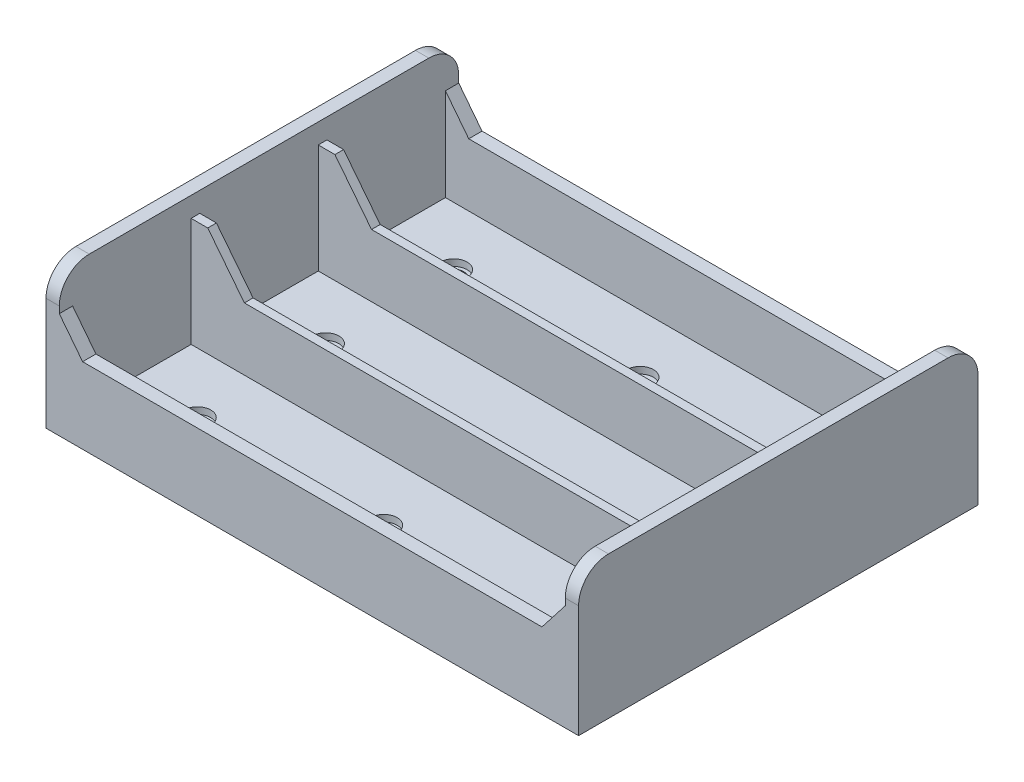
from build123d import *

# Parameters (mm, degrees)
SKETCH_1_W          = 80
SKETCH_1_H          = 60
EXTRUDE_1_DEPTH     = 21.4
FILLET_1_R          = 4.5
CUT_EXTRUDE_1_DEPTH = 77.675595548
SKETCH_3_W          = 76
SKETCH_3_H          = 56
CUT_EXTRUDE_2_DEPTH = 19.4
SKETCH_4_W          = 76
SKETCH_4_H          = 1.3
EXTRUDE_2_DEPTH     = 16.4
CUT_EXTRUDE_3_DEPTH = 26.4
CUT_EXTRUDE_4_REACH = 63.858
SKETCH_6_R          = 1.25
SKETCH_6_R_2        = 1.5
SKETCH_7_R          = 2
CUT_EXTRUDE_5_DEPTH = 1


with BuildPart() as part:
    # 草图1 → 凸台-拉伸1 (new body)
    with BuildSketch(Plane(origin=(0, 0, 0), x_dir=(1, 0, 0), z_dir=(0, 1, 0))):
        with Locations((2.675367047, -10.358890701)):
            Rectangle(SKETCH_1_W, SKETCH_1_H)
    extrude(amount=EXTRUDE_1_DEPTH)

    # 圆角1
    fillet_1_edges = [part.edges().sort_by_distance(p)[0] for p in [
        (2.675367047, 21.4, -19.641109299),
        (2.675367047, 21.4, 40.358890701),
    ]]
    fillet(fillet_1_edges, radius=FILLET_1_R)

    # 草图2 → 切除-拉伸1 (cut, through all)
    with BuildSketch(Plane.XY.offset(40.358890701)):
        Polygon((40.675367047, 21.4), (-35.324632953, 21.4), (-35.324632953, 15.9), (-31.824632953, 11.4), (37.175367047, 11.4), (40.675367047, 15.9), align=None)
    extrude(amount=-CUT_EXTRUDE_1_DEPTH, mode=Mode.SUBTRACT)

    # 草图3 → 切除-拉伸2 (cut)
    with BuildSketch(Plane(origin=(0, 21.4, 0), x_dir=(1, 0, 0), z_dir=(0, 1, 0))):
        with Locations((2.675367047, -10.358890701)):
            Rectangle(SKETCH_3_W, SKETCH_3_H)
    extrude(amount=-CUT_EXTRUDE_2_DEPTH, mode=Mode.SUBTRACT)

    # 草图4 → 凸台-拉伸2 (add)
    with BuildSketch(Plane(origin=(0, 2, 0), x_dir=(1, 0, 0), z_dir=(0, 1, 0))):
        with Locations((2.675367047, -0.808890701)):
            Rectangle(SKETCH_4_W, SKETCH_4_H)
        with Locations((2.675367047, -19.908890701)):
            Rectangle(SKETCH_4_W, SKETCH_4_H)
    extrude(amount=EXTRUDE_2_DEPTH)

    # 草图5 → 切除-拉伸3 (cut)
    with BuildSketch(Plane.XY.offset(20.558890701)):
        Polygon((-32.824984691, 18.4), (-27.324632953, 11.4), (32.675367047, 11.4), (38.175367047, 18.4), align=None)
    extrude(amount=-CUT_EXTRUDE_3_DEPTH, mode=Mode.SUBTRACT)

    # 草图6 → 切除-拉伸4 (cut, up to next)
    with BuildSketch(Plane(origin=(0, 2, 0), x_dir=(1, 0, 0), z_dir=(0, 1, 0)), mode=Mode.PRIVATE) as cut_extrude_4_sk1:
        with Locations(Location((2.675367047, 8.891109299, 0), (0, 0, 270))):
            Circle(SKETCH_6_R)
    cut_extrude_4_tool1 = extrude(cut_extrude_4_sk1.sketch, amount=-CUT_EXTRUDE_4_REACH, mode=Mode.PRIVATE) & part.part
    # 草图6 → 切除-拉伸4 (cut, up to next)
    with BuildSketch(Plane(origin=(0, 2, 0), x_dir=(1, 0, 0), z_dir=(0, 1, 0)), mode=Mode.PRIVATE) as cut_extrude_4_sk2:
        with Locations(Location((2.675367047, -29.608890701, 0), (0, 0, 270))):
            Circle(SKETCH_6_R)
    cut_extrude_4_tool2 = extrude(cut_extrude_4_sk2.sketch, amount=-CUT_EXTRUDE_4_REACH, mode=Mode.PRIVATE) & part.part
    # 草图6 → 切除-拉伸4 (cut, up to next)
    with BuildSketch(Plane(origin=(0, 2, 0), x_dir=(1, 0, 0), z_dir=(0, 1, 0)), mode=Mode.PRIVATE) as cut_extrude_4_sk3:
        with Locations(Location((-25.324632953, 8.891109299, 0), (0, 0, 270))):
            Circle(SKETCH_6_R_2)
    cut_extrude_4_tool3 = extrude(cut_extrude_4_sk3.sketch, amount=-CUT_EXTRUDE_4_REACH, mode=Mode.PRIVATE) & part.part
    # 草图6 → 切除-拉伸4 (cut, up to next)
    with BuildSketch(Plane(origin=(0, 2, 0), x_dir=(1, 0, 0), z_dir=(0, 1, 0)), mode=Mode.PRIVATE) as cut_extrude_4_sk4:
        with Locations(Location((30.675367047, 8.891109299, 0), (0, 0, 270))):
            Circle(SKETCH_6_R_2)
    cut_extrude_4_tool4 = extrude(cut_extrude_4_sk4.sketch, amount=-CUT_EXTRUDE_4_REACH, mode=Mode.PRIVATE) & part.part
    # 草图6 → 切除-拉伸4 (cut, up to next)
    with BuildSketch(Plane(origin=(0, 2, 0), x_dir=(1, 0, 0), z_dir=(0, 1, 0)), mode=Mode.PRIVATE) as cut_extrude_4_sk5:
        with Locations(Location((30.675367047, -10.829122265, 0), (0, 0, 270))):
            Circle(SKETCH_6_R_2)
    cut_extrude_4_tool5 = extrude(cut_extrude_4_sk5.sketch, amount=-CUT_EXTRUDE_4_REACH, mode=Mode.PRIVATE) & part.part
    # 草图6 → 切除-拉伸4 (cut, up to next)
    with BuildSketch(Plane(origin=(0, 2, 0), x_dir=(1, 0, 0), z_dir=(0, 1, 0)), mode=Mode.PRIVATE) as cut_extrude_4_sk6:
        with Locations(Location((30.675367047, -29.608890701, 0), (0, 0, 270))):
            Circle(SKETCH_6_R_2)
    cut_extrude_4_tool6 = extrude(cut_extrude_4_sk6.sketch, amount=-CUT_EXTRUDE_4_REACH, mode=Mode.PRIVATE) & part.part
    # 草图6 → 切除-拉伸4 (cut, up to next)
    with BuildSketch(Plane(origin=(0, 2, 0), x_dir=(1, 0, 0), z_dir=(0, 1, 0)), mode=Mode.PRIVATE) as cut_extrude_4_sk7:
        with Locations(Location((-25.324632953, -29.608890701, 0), (0, 0, 270))):
            Circle(SKETCH_6_R_2)
    cut_extrude_4_tool7 = extrude(cut_extrude_4_sk7.sketch, amount=-CUT_EXTRUDE_4_REACH, mode=Mode.PRIVATE) & part.part
    # 草图6 → 切除-拉伸4 (cut, up to next)
    with BuildSketch(Plane(origin=(0, 2, 0), x_dir=(1, 0, 0), z_dir=(0, 1, 0)), mode=Mode.PRIVATE) as cut_extrude_4_sk8:
        with Locations(Location((-25.324632953, -10.358890701, 0), (0, 0, 270))):
            Circle(SKETCH_6_R_2)
    cut_extrude_4_tool8 = extrude(cut_extrude_4_sk8.sketch, amount=-CUT_EXTRUDE_4_REACH, mode=Mode.PRIVATE) & part.part
    add(cut_extrude_4_tool1.solids().sort_by_distance((2.675367, 2, -8.891109))[0], mode=Mode.SUBTRACT)
    add(cut_extrude_4_tool2.solids().sort_by_distance((2.675367, 2, 29.608891))[0], mode=Mode.SUBTRACT)
    add(cut_extrude_4_tool3.solids().sort_by_distance((-25.324633, 2, -8.891109))[0], mode=Mode.SUBTRACT)
    add(cut_extrude_4_tool4.solids().sort_by_distance((30.675367, 2, -8.891109))[0], mode=Mode.SUBTRACT)
    add(cut_extrude_4_tool5.solids().sort_by_distance((30.675367, 2, 10.829122))[0], mode=Mode.SUBTRACT)
    add(cut_extrude_4_tool6.solids().sort_by_distance((30.675367, 2, 29.608891))[0], mode=Mode.SUBTRACT)
    add(cut_extrude_4_tool7.solids().sort_by_distance((-25.324633, 2, 29.608891))[0], mode=Mode.SUBTRACT)
    add(cut_extrude_4_tool8.solids().sort_by_distance((-25.324633, 2, 10.358891))[0], mode=Mode.SUBTRACT)

    # 草图7 → 切除-拉伸5 (cut)
    with BuildSketch(Plane(origin=(0, 2, 0), x_dir=(1, 0, 0), z_dir=(0, 1, 0))):
        with Locations(Location((-25.324632953, 8.891109299, 0), (0, 0, 270))):
            Circle(SKETCH_7_R)
        with Locations(Location((2.675367047, 8.891109299, 0), (0, 0, 270))):
            Circle(SKETCH_7_R)
        with Locations(Location((30.675367047, 8.891109299, 0), (0, 0, 270))):
            Circle(SKETCH_7_R)
        with Locations(Location((-25.324632953, -10.358890701, 0), (0, 0, 270))):
            Circle(SKETCH_7_R)
        with Locations(Location((30.675367047, -10.829122265, 0), (0, 0, 270))):
            Circle(SKETCH_7_R)
        with Locations(Location((-25.324632953, -29.608890701, 0), (0, 0, 270))):
            Circle(SKETCH_7_R)
        with Locations(Location((2.675367047, -29.608890701, 0), (0, 0, 270))):
            Circle(SKETCH_7_R)
        with Locations(Location((30.675367047, -29.608890701, 0), (0, 0, 270))):
            Circle(SKETCH_7_R)
    extrude(amount=-CUT_EXTRUDE_5_DEPTH, mode=Mode.SUBTRACT)


solid = part.part
